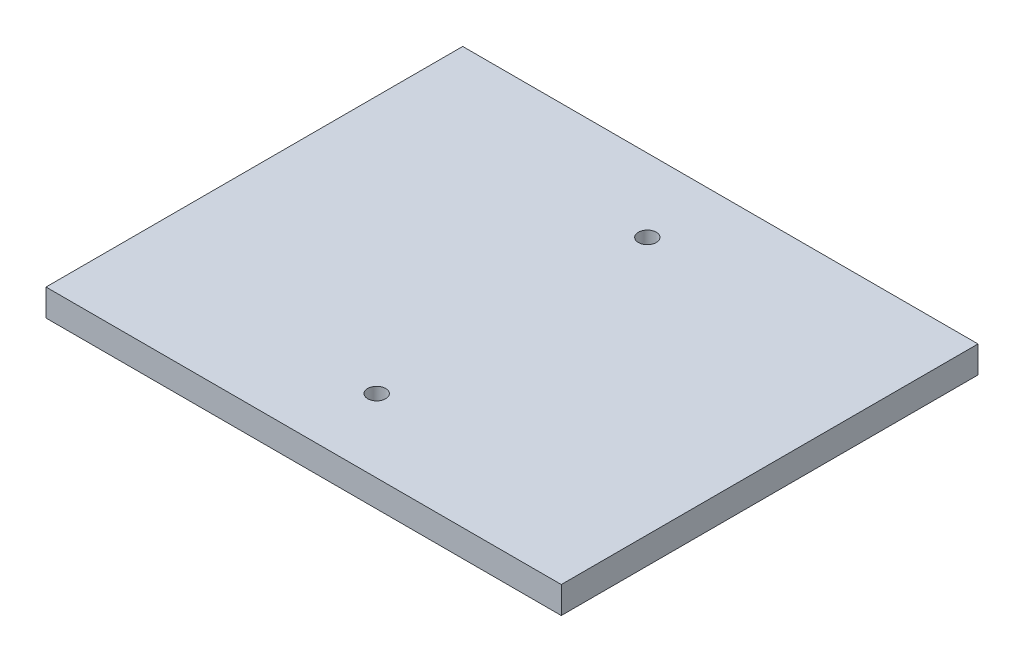
from build123d import *

# Parameters (mm, degrees)
SKETCH_1_W          = 57.5
SKETCH_1_H          = 46.5
EXTRUDE_1_DEPTH     = 3
SKETCH_2_R          = 1
CUT_EXTRUDE_1_DEPTH = 38.096158831
SKETCH_4_R          = 2.6
CUT_EXTRUDE_2_DEPTH = 0.8


with BuildPart() as part:
    # 草图1 → 凸台-拉伸1 (new body)
    with BuildSketch(Plane(origin=(0, 0, 0), x_dir=(1, 0, 0), z_dir=(0, 1, 0))):
        Rectangle(SKETCH_1_W, SKETCH_1_H)
    extrude(amount=EXTRUDE_1_DEPTH)

    # 草图2 → 切除-拉伸1 (cut, through all)
    with BuildSketch(Plane(origin=(0, 3, 0), x_dir=(1, 0, 0), z_dir=(0, 1, 0))):
        with Locations(Location((0, -15.1, 0), (0, 0, 270))):
            Circle(SKETCH_2_R)
        with Locations(Location((0, 15.1, 0), (0, 0, 270))):
            Circle(SKETCH_2_R)
    extrude(amount=-CUT_EXTRUDE_1_DEPTH, mode=Mode.SUBTRACT)

    # 草图4 → 切除-拉伸2 (cut)
    with BuildSketch(Plane.XZ):
        with Locations(Location((-20.75, 15.25, 0), (0, 0, 270))):
            Circle(SKETCH_4_R)
        with Locations(Location((20.75, 15.25, 0), (0, 0, 90))):
            Circle(SKETCH_4_R)
        with Locations(Location((-20.75, -15.25, 0), (0, 0, 90))):
            Circle(SKETCH_4_R)
        with Locations(Location((20.75, -15.25, 0), (0, 0, 270))):
            Circle(SKETCH_4_R)
    extrude(amount=-CUT_EXTRUDE_2_DEPTH, mode=Mode.SUBTRACT)


solid = part.part
